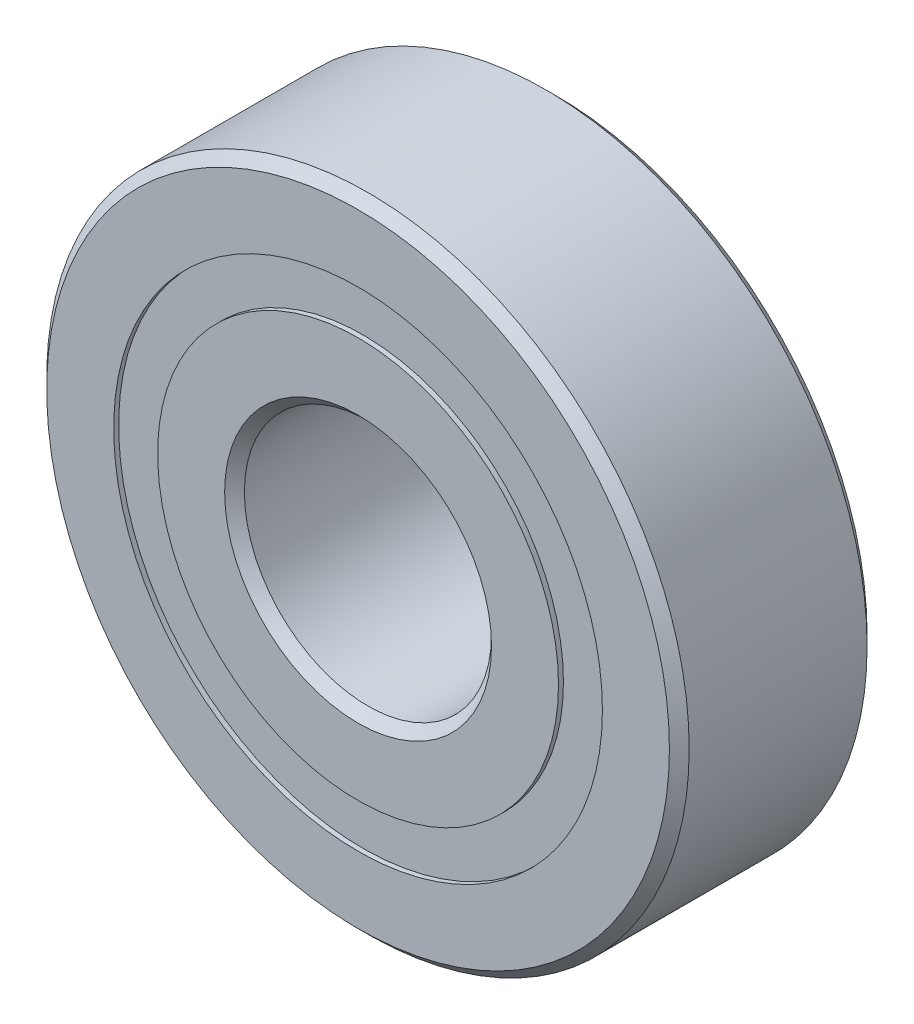
from build123d import *

# Parameters (mm, degrees)
CIRPATTERN1_COUNT = 13
SKETCH5_W         = 0.90619201
SKETCH5_H         = 0.888888888


with BuildPart() as part:
    # Sketch1 → Revolve1 (revolve)
    with BuildSketch(Plane(origin=(0, 0, 0), x_dir=(0, 0, -1), z_dir=(1, 0, 0))):
        with BuildLine():
            Line((1.8, 6.5), (-1.8, 6.5))
            Line((-1.8, 6.5), (-2, 6.3))
            Line((-2, 6.3), (-2, 4.944444444))
            Line((-2, 4.944444444), (-0.888888889, 4.944444444))
            ThreePointArc((-0.888888889, 4.944444444), (0, 5.49380799), (0.888888889, 4.944444444))
            Line((0.888888889, 4.944444444), (2, 4.944444444))
            Line((2, 4.944444444), (2, 6.3))
            Line((2, 6.3), (1.8, 6.5))
        make_face()
    revolve(axis=Axis((0, 0, 2), (0, 0, -1)))


with BuildPart() as body_2:
    # Sketch2 → Revolve2 (revolve)
    with BuildSketch(Plane(origin=(0, 0, 0), x_dir=(0, 0, -1), z_dir=(1, 0, 0))):
        with BuildLine():
            Line((-2, 4.055555556), (-0.888888889, 4.055555556))
            ThreePointArc((-0.888888889, 4.055555556), (0, 3.50619201), (0.888888889, 4.055555556))
            Line((0.888888889, 4.055555556), (2, 4.055555556))
            Line((2, 4.055555556), (2, 2.7))
            Line((2, 2.7), (1.8, 2.5))
            Line((1.8, 2.5), (-1.8, 2.5))
            Line((-1.8, 2.5), (-2, 2.7))
            Line((-2, 2.7), (-2, 4.055555556))
        make_face()
    revolve(axis=Axis((0, 0, 2), (0, 0, -1)))


with BuildPart() as body_3:
    # Sketch3 → Revolve3 (revolve)
    with BuildSketch(Plane(origin=(0, 0, 0), x_dir=(0, 0, -1), z_dir=(1, 0, 0))):
        with BuildLine():
            Line((-0.99380799, 4.5), (0.99380799, 4.5))
            ThreePointArc((0.99380799, 4.5), (0, 5.49380799), (-0.99380799, 4.5))
        make_face()
    revolve(axis=Axis((0, 4.5, 0.99380799), (0, 0, -1)))


with BuildPart() as cirpattern1_1:
    # CirPattern1: pattern copy
    add(body_3.part.rotate(Axis((0, 0, -2), (0, 0, 1)), 1 * 360 / CIRPATTERN1_COUNT))


with BuildPart() as cirpattern1_2:
    # CirPattern1: pattern copy
    add(body_3.part.rotate(Axis((0, 0, -2), (0, 0, 1)), 2 * 360 / CIRPATTERN1_COUNT))


with BuildPart() as cirpattern1_3:
    # CirPattern1: pattern copy
    add(body_3.part.rotate(Axis((0, 0, -2), (0, 0, 1)), 3 * 360 / CIRPATTERN1_COUNT))


with BuildPart() as cirpattern1_4:
    # CirPattern1: pattern copy
    add(body_3.part.rotate(Axis((0, 0, -2), (0, 0, 1)), 4 * 360 / CIRPATTERN1_COUNT))


with BuildPart() as cirpattern1_5:
    # CirPattern1: pattern copy
    add(body_3.part.rotate(Axis((0, 0, -2), (0, 0, 1)), 5 * 360 / CIRPATTERN1_COUNT))


with BuildPart() as cirpattern1_6:
    # CirPattern1: pattern copy
    add(body_3.part.rotate(Axis((0, 0, -2), (0, 0, 1)), 6 * 360 / CIRPATTERN1_COUNT))


with BuildPart() as cirpattern1_7:
    # CirPattern1: pattern copy
    add(body_3.part.rotate(Axis((0, 0, -2), (0, 0, 1)), 7 * 360 / CIRPATTERN1_COUNT))


with BuildPart() as cirpattern1_8:
    # CirPattern1: pattern copy
    add(body_3.part.rotate(Axis((0, 0, -2), (0, 0, 1)), 8 * 360 / CIRPATTERN1_COUNT))


with BuildPart() as cirpattern1_9:
    # CirPattern1: pattern copy
    add(body_3.part.rotate(Axis((0, 0, -2), (0, 0, 1)), 9 * 360 / CIRPATTERN1_COUNT))


with BuildPart() as cirpattern1_10:
    # CirPattern1: pattern copy
    add(body_3.part.rotate(Axis((0, 0, -2), (0, 0, 1)), 10 * 360 / CIRPATTERN1_COUNT))


with BuildPart() as cirpattern1_11:
    # CirPattern1: pattern copy
    add(body_3.part.rotate(Axis((0, 0, -2), (0, 0, 1)), 11 * 360 / CIRPATTERN1_COUNT))


with BuildPart() as cirpattern1_12:
    # CirPattern1: pattern copy
    add(body_3.part.rotate(Axis((0, 0, -2), (0, 0, 1)), 12 * 360 / CIRPATTERN1_COUNT))


with BuildPart() as body_16:
    # Sketch5 → Revolve5 (revolve)
    with BuildSketch(Plane(origin=(0, 0, 0), x_dir=(0, 0, -1), z_dir=(1, 0, 0))):
        with Locations((-1.446903995, 4.5)):
            Rectangle(SKETCH5_W, SKETCH5_H)
        with Locations((1.446903995, 4.5)):
            Rectangle(SKETCH5_W, SKETCH5_H)
    revolve(axis=Axis((0, 0, 2), (0, 0, -1)))


solid = Compound([part.part, body_2.part, body_3.part, cirpattern1_1.part, cirpattern1_2.part, cirpattern1_3.part, cirpattern1_4.part, cirpattern1_5.part, cirpattern1_6.part, cirpattern1_7.part, cirpattern1_8.part, cirpattern1_9.part, cirpattern1_10.part, cirpattern1_11.part, cirpattern1_12.part, body_16.part])
